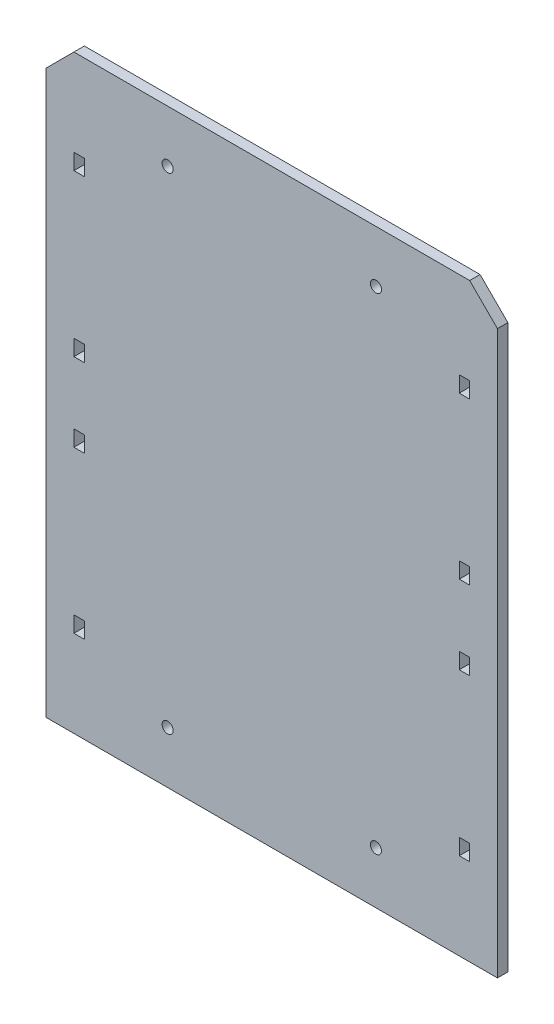
from build123d import *

# Parameters (mm, degrees)
SKETCH_1_R      = 1.6
SKETCH_1_W      = 3
SKETCH_1_H      = 4.6
EXTRUDE_1_DEPTH = 3


with BuildPart() as part:
    # ｽｹｯﾁ1 → ﾎﾞｽ - 押し出し1 (new body)
    with BuildSketch(Plane.XY):
        Polygon((0, 162), (8, 170), (122, 170), (130, 162), (130, 0), (0, 0), align=None)
        with Locations((35, 155)):
            Circle(SKETCH_1_R, mode=Mode.SUBTRACT)
        with Locations((95, 155)):
            Circle(SKETCH_1_R, mode=Mode.SUBTRACT)
        with Locations((35, 15)):
            Circle(SKETCH_1_R, mode=Mode.SUBTRACT)
        with Locations((95, 15)):
            Circle(SKETCH_1_R, mode=Mode.SUBTRACT)
        with Locations((9.5, 142.7)):
            Rectangle(SKETCH_1_W, SKETCH_1_H, mode=Mode.SUBTRACT)
        with Locations((120.5, 142.7)):
            Rectangle(SKETCH_1_W, SKETCH_1_H, mode=Mode.SUBTRACT)
        with Locations((9.5, 27.3)):
            Rectangle(SKETCH_1_W, SKETCH_1_H, mode=Mode.SUBTRACT)
        with Locations((120.5, 27.3)):
            Rectangle(SKETCH_1_W, SKETCH_1_H, mode=Mode.SUBTRACT)
        with Locations((9.5, 96.3)):
            Rectangle(SKETCH_1_W, SKETCH_1_H, mode=Mode.SUBTRACT)
        with Locations((120.5, 96.3)):
            Rectangle(SKETCH_1_W, SKETCH_1_H, mode=Mode.SUBTRACT)
        with Locations((9.5, 73.7)):
            Rectangle(SKETCH_1_W, SKETCH_1_H, mode=Mode.SUBTRACT)
        with Locations((120.5, 73.7)):
            Rectangle(SKETCH_1_W, SKETCH_1_H, mode=Mode.SUBTRACT)
    extrude(amount=EXTRUDE_1_DEPTH)


solid = part.part
